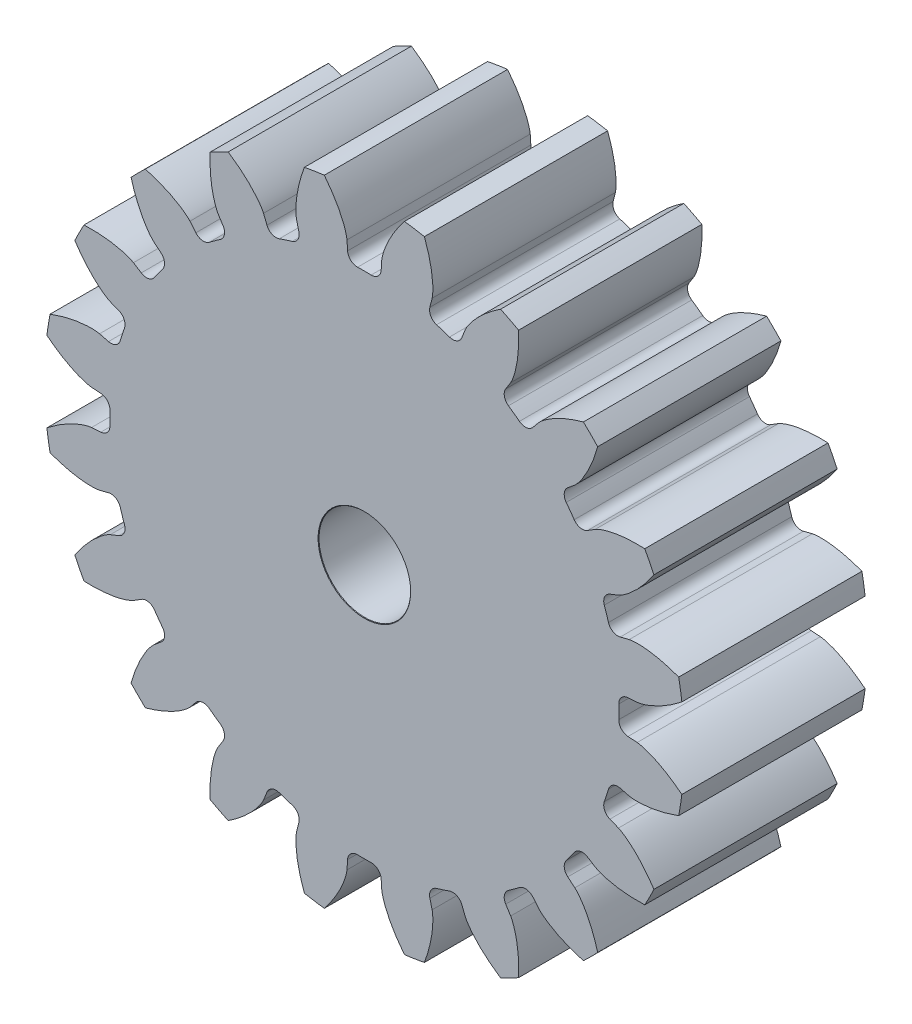
from build123d import *

# Parameters (mm, degrees)
BOSS_EXTRUDE1_DEPTH             = 5
BOSS_EXTRUDE1_DEPTH_BACK        = 5
SKETCH3_R                       = 17.4625
CUT_EXTRUDE1_DEPTH              = 26.196781789
FILLET1_R                       = 0.532614244
CIRPATTERN1_COUNT               = 20
FILLET1_OF_CIRPATTERN1_R        = 0.532614244
F_5_0MM_DOWEL_HOLE1_D           = 5
F_5_0MM_DOWEL_HOLE1_CSINK_D     = 5.05
F_5_0MM_DOWEL_HOLE1_CSINK_ANGLE = 90


with BuildPart() as part:
    # Sketch3 → Boss-Extrude1 (new, two sides: drawn at the far end of the back side and taken through both)
    with BuildSketch(Plane.XY.offset(-BOSS_EXTRUDE1_DEPTH_BACK)):
        Circle(SKETCH3_R)
    extrude(amount=BOSS_EXTRUDE1_DEPTH + BOSS_EXTRUDE1_DEPTH_BACK)

    # Sketch4 → Cut-Extrude1 (cut, symmetric)
    with BuildSketch(Plane.XY):
        with BuildLine():
            Line((13.862509667, 0.883339472), (14.887426331, 0.948648666))
            add(Edge.make_bspline(
                [(14.887426331, 0.948648666), (14.891498563, 0.948960837), (14.902907966, 0.949998784), (14.924427276, 0.952602167), (14.95945375, 0.957759415), (15.003941844, 0.965665547), (15.061257894, 0.977414438), (15.128515995, 0.993219372), (15.202129015, 1.0126422), (15.281861626, 1.035984148), (15.361069319, 1.061221577), (15.439747317, 1.088207697), (15.517806043, 1.116720088), (15.611962192, 1.153177884), (15.724296012, 1.199560006), (15.854707485, 1.257639514), (16.001517137, 1.328059621), (16.14988557, 1.404665091), (16.294820791, 1.484009508), (16.439960894, 1.568702983), (16.579466721, 1.653854051), (16.722947307, 1.746895606), (16.854669468, 1.835118724), (17.000583085, 1.939004457), (17.117858242, 2.024317764), (17.23755882, 2.116622434), (17.295602058, 2.162162412), (17.325173756, 2.185694532)],
                knots=[0, 0, 0, 0, 0, 0.005376749, 0.015083688, 0.02853182, 0.04661014, 0.064854849, 0.092110526, 0.119476176, 0.146842496, 0.174208854, 0.201574956, 0.228941013, 0.256307345, 0.307035032, 0.361767352, 0.416499661, 0.471231937, 0.525964282, 0.580696616, 0.635428982, 0.690161387, 0.744893688, 0.799626082, 0.854358407, 0.909090915, 0.909090915, 0.909090915, 0.909090915, 0.909090915], degree=4))
            ThreePointArc((17.325173756, 2.185694532), (17.4625, 0), (17.325173756, -2.185694532))
            add(Edge.make_bspline(
                [(14.887426331, -0.948648666), (14.891498563, -0.948960837), (14.902907966, -0.949998784), (14.924427276, -0.952602167), (14.95945375, -0.957759415), (15.003941844, -0.965665547), (15.061257894, -0.977414438), (15.128515995, -0.993219372), (15.202129015, -1.0126422), (15.281861626, -1.035984148), (15.361069319, -1.061221577), (15.439747317, -1.088207697), (15.517806043, -1.116720088), (15.611962192, -1.153177884), (15.724296012, -1.199560006), (15.854707485, -1.257639514), (16.001517137, -1.328059621), (16.14988557, -1.404665091), (16.294820791, -1.484009508), (16.439960894, -1.568702983), (16.579466721, -1.653854051), (16.722947307, -1.746895606), (16.854669468, -1.835118724), (17.000583085, -1.939004457), (17.117858242, -2.024317764), (17.23755882, -2.116622434), (17.295602058, -2.162162412), (17.325173756, -2.185694532)],
                knots=[0, 0, 0, 0, 0, 0.005376749, 0.015083688, 0.02853182, 0.04661014, 0.064854849, 0.092110526, 0.119476176, 0.146842496, 0.174208854, 0.201574956, 0.228941013, 0.256307345, 0.307035032, 0.361767352, 0.416499661, 0.471231937, 0.525964282, 0.580696616, 0.635428982, 0.690161387, 0.744893688, 0.799626082, 0.854358407, 0.909090915, 0.909090915, 0.909090915, 0.909090915, 0.909090915], degree=4))
            Line((14.887426331, -0.948648666), (13.862509667, -0.883339472))
            ThreePointArc((13.862509667, -0.883339472), (13.890625, 0), (13.862509667, 0.883339472))
        make_face()
    cut_extrude1 = extrude(amount=CUT_EXTRUDE1_DEPTH, both=True, mode=Mode.SUBTRACT)

    # Fillet1
    fillet1_edges = [part.edges().sort_by_distance(p)[0] for p in [
        (13.862509667, -0.883339472, 0),
        (13.862509667, 0.883339472, 0),
    ]]
    fillet(fillet1_edges, radius=FILLET1_R)

    # CirPattern1: Cut-Extrude1 ×20 about axis
    cirpattern1_axis = Axis((0, 0, 5.000000033), (0, 0, -1))
    for i in range(1, CIRPATTERN1_COUNT):
        add(cut_extrude1.rotate(cirpattern1_axis, i * 360 / CIRPATTERN1_COUNT), mode=Mode.SUBTRACT)

    # Fillet1 of CirPattern1
    fillet1_of_cirpattern1_edges = [part.edges().sort_by_distance(p)[0] for p in [
        (12.911063243, -5.123856832, 0),
        (13.45699706, -3.443645311, 0),
        (10.695791991, -8.862815386, 0),
        (11.734219819, -7.433542098, 0),
        (7.433542098, -11.734219819, 0),
        (8.862815386, -10.695791991, 0),
        (3.443645311, -13.45699706, 0),
        (5.123856832, -12.911063243, 0),
        (-0.883339472, -13.862509667, 0),
        (0.883339472, -13.862509667, 0),
        (-5.123856832, -12.911063243, 0),
        (-3.443645311, -13.45699706, 0),
        (-8.862815386, -10.695791991, 0),
        (-7.433542098, -11.734219819, 0),
        (-11.734219819, -7.433542098, 0),
        (-10.695791991, -8.862815386, 0),
        (-13.45699706, -3.443645311, 0),
        (-12.911063243, -5.123856832, 0),
        (-13.862509667, 0.883339472, 0),
        (-13.862509667, -0.883339472, 0),
        (-12.911063243, 5.123856832, 0),
        (-13.45699706, 3.443645311, 0),
        (-10.695791991, 8.862815386, 0),
        (-11.734219819, 7.433542098, 0),
        (-7.433542098, 11.734219819, 0),
        (-8.862815386, 10.695791991, 0),
        (-3.443645311, 13.45699706, 0),
        (-5.123856832, 12.911063243, 0),
        (0.883339472, 13.862509667, 0),
        (-0.883339472, 13.862509667, 0),
        (5.123856832, 12.911063243, 0),
        (3.443645311, 13.45699706, 0),
        (8.862815386, 10.695791991, 0),
        (7.433542098, 11.734219819, 0),
        (11.734219819, 7.433542098, 0),
        (10.695791991, 8.862815386, 0),
        (13.45699706, 3.443645311, 0),
        (12.911063243, 5.123856832, 0),
    ]]
    fillet(fillet1_of_cirpattern1_edges, radius=FILLET1_OF_CIRPATTERN1_R)

    # Ø5.0mm Dowel Hole1 (through all)
    with Locations(Plane.XY.offset(5.000000033)):
        with Locations((0, 0)):
            CounterSinkHole(F_5_0MM_DOWEL_HOLE1_D / 2, F_5_0MM_DOWEL_HOLE1_CSINK_D / 2, counter_sink_angle=F_5_0MM_DOWEL_HOLE1_CSINK_ANGLE)


solid = part.part
